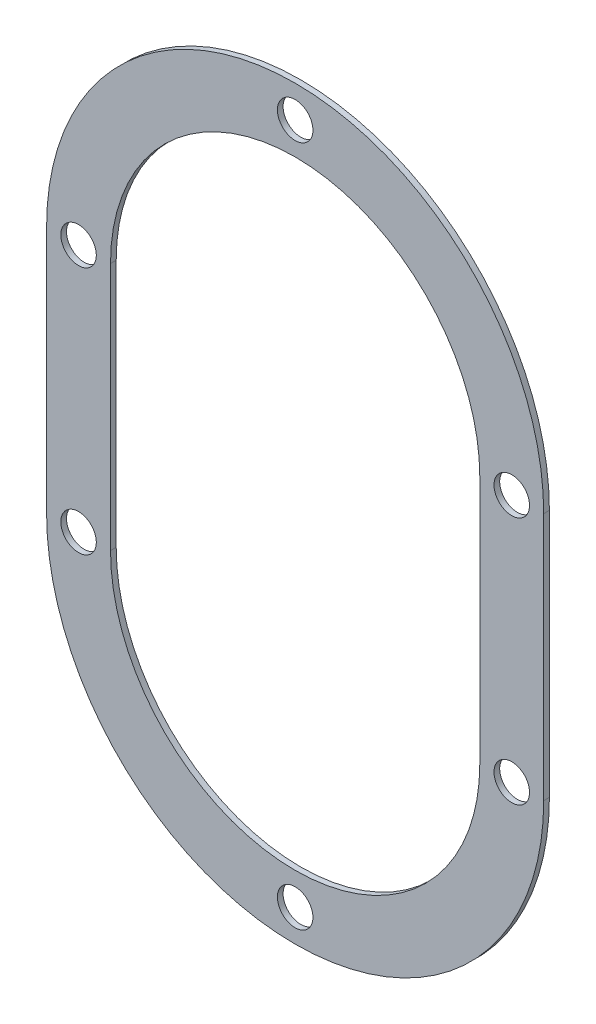
from build123d import *

# Parameters (mm, degrees)
SKETCH1_R           = 2.5
BOSS_EXTRUDE1_DEPTH = 0.8
SCALE1_SCALE        = 0.317565217


with BuildPart() as part:
    # Sketch1 → Boss-Extrude1 (new body)
    with BuildSketch(Plane.XY):
        with BuildLine():
            Line((-35, 0), (-35, -35))
            ThreePointArc((-35, -35), (0, -70), (35, -35))
            Line((35, -35), (35, 0))
            ThreePointArc((35, 0), (0, 35), (-35, 0))
        make_face()
        with Locations((-30.5, 0)):
            Circle(SKETCH1_R, mode=Mode.SUBTRACT)
        with Locations((0, 30.5)):
            Circle(SKETCH1_R, mode=Mode.SUBTRACT)
        with Locations((30.5, 0)):
            Circle(SKETCH1_R, mode=Mode.SUBTRACT)
        with Locations((30.5, -35)):
            Circle(SKETCH1_R, mode=Mode.SUBTRACT)
        with Locations((0, -65.5)):
            Circle(SKETCH1_R, mode=Mode.SUBTRACT)
        with Locations((-30.5, -35)):
            Circle(SKETCH1_R, mode=Mode.SUBTRACT)
        with BuildLine():
            Line((-26, 0), (-26, -35))
            ThreePointArc((-26, -35), (0, -61), (26, -35))
            Line((26, -35), (26, 0))
            ThreePointArc((26, 0), (0, 26), (-26, 0))
        make_face(mode=Mode.SUBTRACT)
    extrude(amount=BOSS_EXTRUDE1_DEPTH)


with BuildPart() as part_1:
    # Scale1: scaled about (0, -17.5, 0.4)
    add(part.part.scale(SCALE1_SCALE).moved(Location((0, -11.942608696, 0.272973913))))


solid = part_1.part
